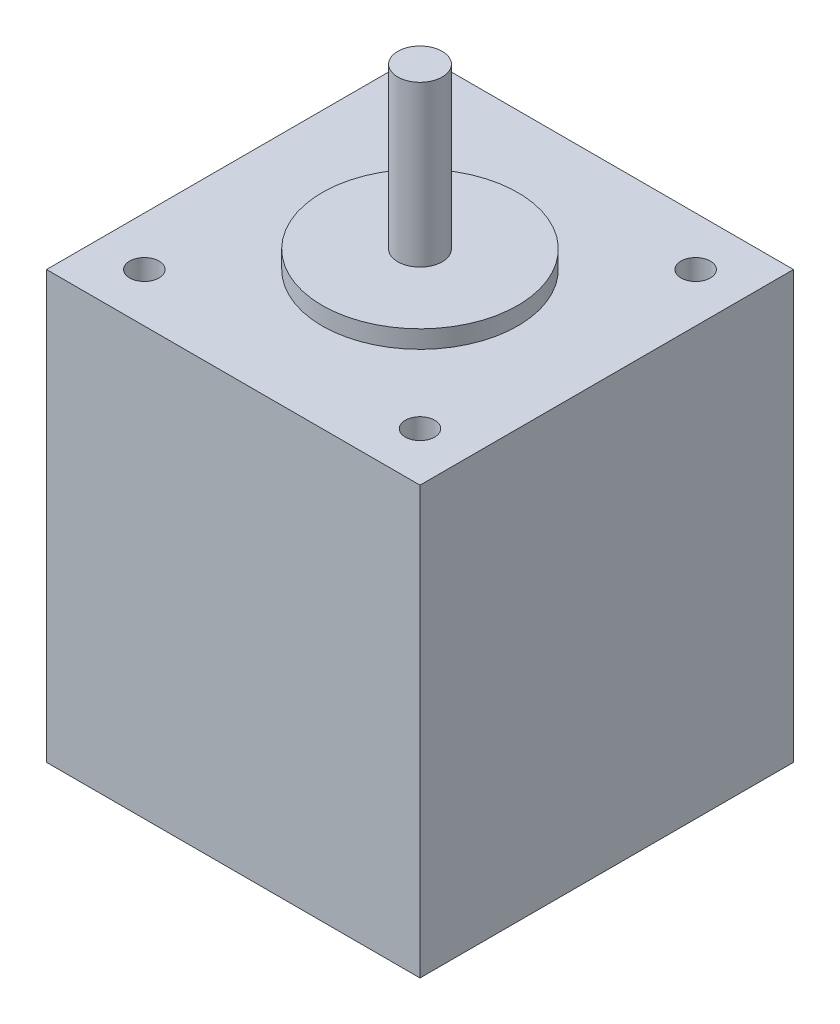
from build123d import *

# Parameters (mm, degrees)
SKETCH1_W                            = 42
SKETCH1_H                            = 42
BOSS_EXTRUDE1_DEPTH                  = 48
SKETCH2_R                            = 2.5
BOSS_EXTRUDE2_DEPTH                  = 20
SKETCH4_W                            = 1.65
SKETCH4_H                            = 48
TAP_DRILL_FOR_M4X0_7_TAP1_AT_2_COUNT = 2
TAP_DRILL_FOR_M4X0_7_TAP1_AT_2_PITCH = 31
TAP_DRILL_FOR_M4X0_7_TAP1_AT_3_COUNT = 2
TAP_DRILL_FOR_M4X0_7_TAP1_AT_3_PITCH = 43.840620434
TAP_DRILL_FOR_M4X0_7_TAP1_AT_4_COUNT = 2
TAP_DRILL_FOR_M4X0_7_TAP1_AT_4_PITCH = 31
TAP_DRILL_FOR_M4X0_7_TAP1_AT_5_COUNT = 2
TAP_DRILL_FOR_M4X0_7_TAP1_AT_5_PITCH = 21.920310217
SKETCH6_R                            = 11
BOSS_EXTRUDE3_DEPTH                  = 2


with BuildPart() as part:
    # Sketch1 → Boss-Extrude1 (new body)
    with BuildSketch(Plane(origin=(0, 0, 0), x_dir=(1, 0, 0), z_dir=(0, 1, 0))):
        Rectangle(SKETCH1_W, SKETCH1_H)
    extrude(amount=BOSS_EXTRUDE1_DEPTH)

    # Sketch2 → Boss-Extrude2 (add)
    with BuildSketch(Plane(origin=(0, 48, 0), x_dir=(1, 0, 0), z_dir=(0, 1, 0))):
        with Locations(Location((0, 0, 0), (0, 0, 270))):
            Circle(SKETCH2_R)
    extrude(amount=BOSS_EXTRUDE2_DEPTH)

    # Sketch4 → Tap Drill for M4x0.7 Tap1 (revolve, cut)
    with BuildSketch(Plane(origin=(-15.5, 48, -15.5), x_dir=(0, 0, 1), z_dir=(1, 0, 0))):
        with Locations((0.825, 24)):
            Rectangle(SKETCH4_W, SKETCH4_H)
    tap_drill_for_m4x0_7_tap1 = revolve(axis=Axis((-15.5, 54.35, -15.5), (0, -1, 0)), mode=Mode.SUBTRACT)

    # Tap Drill for M4x0.7 Tap1 at 2: Tap Drill for M4x0.7 Tap1 ×2
    with Locations(*[(0, 0, i * TAP_DRILL_FOR_M4X0_7_TAP1_AT_2_PITCH) for i in range(1, TAP_DRILL_FOR_M4X0_7_TAP1_AT_2_COUNT)]):
        add(tap_drill_for_m4x0_7_tap1, mode=Mode.SUBTRACT)

    # Tap Drill for M4x0.7 Tap1 at 3: Tap Drill for M4x0.7 Tap1 ×2
    with Locations(*[Vector(0.7071067811865476, 0, 0.7071067811865475) * (i * TAP_DRILL_FOR_M4X0_7_TAP1_AT_3_PITCH) for i in range(1, TAP_DRILL_FOR_M4X0_7_TAP1_AT_3_COUNT)]):
        add(tap_drill_for_m4x0_7_tap1, mode=Mode.SUBTRACT)

    # Tap Drill for M4x0.7 Tap1 at 4: Tap Drill for M4x0.7 Tap1 ×2
    with Locations(*[(i * TAP_DRILL_FOR_M4X0_7_TAP1_AT_4_PITCH, 0, 0) for i in range(1, TAP_DRILL_FOR_M4X0_7_TAP1_AT_4_COUNT)]):
        add(tap_drill_for_m4x0_7_tap1, mode=Mode.SUBTRACT)

    # Tap Drill for M4x0.7 Tap1 at 5: Tap Drill for M4x0.7 Tap1 ×2
    with Locations(*[Vector(0.7071067811865477, 0, 0.7071067811865475) * (i * TAP_DRILL_FOR_M4X0_7_TAP1_AT_5_PITCH) for i in range(1, TAP_DRILL_FOR_M4X0_7_TAP1_AT_5_COUNT)]):
        add(tap_drill_for_m4x0_7_tap1, mode=Mode.SUBTRACT)

    # Sketch6 → Boss-Extrude3 (add)
    with BuildSketch(Plane(origin=(0, 48, 0), x_dir=(1, 0, 0), z_dir=(0, 1, 0))):
        with Locations(Location((0, 0, 0), (0, 0, 270))):
            Circle(SKETCH6_R)
    extrude(amount=BOSS_EXTRUDE3_DEPTH)


solid = part.part
